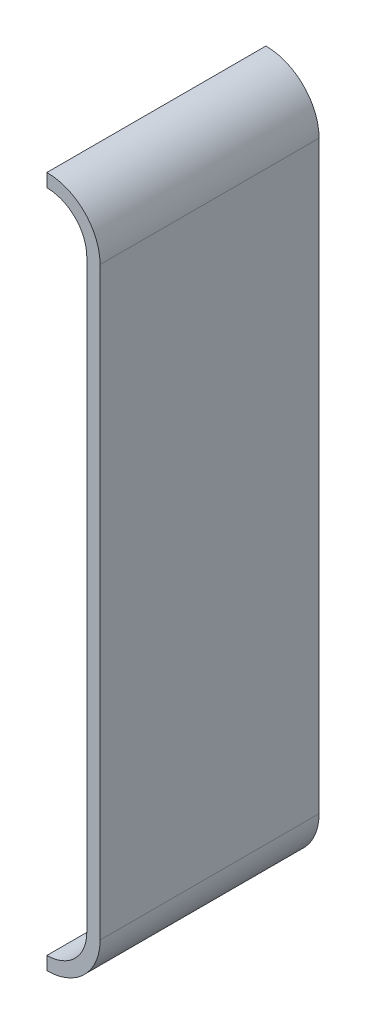
from build123d import *

# Parameters (mm, degrees)
SKETCH1_W           = 52.300000048
SKETCH1_H           = 139.7
BOSS_EXTRUDE1_DEPTH = 3.175
BOSS_EXTRUDE2_DEPTH = 52.300000048


with BuildPart() as part:
    # Sketch1 → Boss-Extrude1 (new body)
    with BuildSketch(Plane(origin=(0, 0, 0), x_dir=(0, 0, -1), z_dir=(1, 0, 0))):
        with Locations((26.150000024, 69.85)):
            Rectangle(SKETCH1_W, SKETCH1_H)
    extrude(amount=BOSS_EXTRUDE1_DEPTH)

    # Sketch2 → Boss-Extrude2 (add)
    with BuildSketch(Plane(origin=(0, 0, -52.300000048), x_dir=(-1, 0, 0), z_dir=(0, 0, -1))):
        with BuildLine():
            Line((9.525, -9.525), (9.525, -12.7))
            ThreePointArc((9.525, -12.7), (0.544743879, -8.980256121), (-3.175, 0))
            Line((-3.175, 0), (0, 0))
            ThreePointArc((0, 0), (2.789807909, -6.735192091), (9.525, -9.525))
        make_face()
        with BuildLine():
            Line((0, 139.7), (-3.175, 139.7))
            ThreePointArc((-3.175, 139.7), (0.544743879, 148.680256121), (9.525, 152.4))
            Line((9.525, 152.4), (9.525, 149.225))
            ThreePointArc((9.525, 149.225), (2.789807909, 146.435192091), (0, 139.7))
        make_face()
    extrude(amount=-BOSS_EXTRUDE2_DEPTH)


solid = part.part
